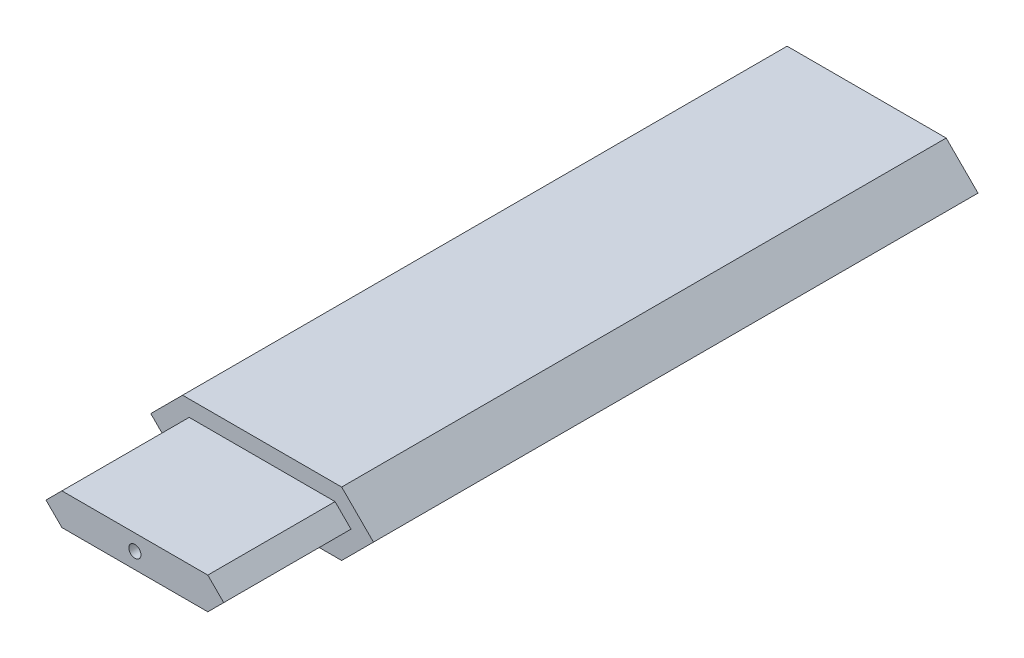
from build123d import *

# Parameters (mm, degrees)
EXTRUDE_1_DEPTH          = 18
CHAMFER_1_SIZE           = 5
CHAMFER_2_SIZE           = 5
CUT_EXTRUDE_1_DEPTH      = 8
EXTRUDE_2_REACH          = 696.741
EXTRUDE_2_END_RADIUS     = 240
EXTRUDE_3_DEPTH          = 5
EXTRUDE_4_REACH          = 929.644
EXTRUDE_4_END_RADIUS     = 232
SKETCH_10_R              = 12
CUT_EXTRUDE_7_DEPTH      = 695.872110635
CUT_EXTRUDE_7_DEPTH_BACK = 695.872110635
SKETCH_16_OUTSIDE_W      = 362.68
SKETCH_16_OUTSIDE_H      = 1204.68
SKETCH_16_OUTSIDE_W_2    = 100
SKETCH_16_OUTSIDE_H_2    = 230
SKETCH_21_R              = 1.9
CUT_EXTRUDE_17_DEPTH     = 233.862620444
SKETCH_34_OUTSIDE_W      = 120.25
SKETCH_34_OUTSIDE_H      = 70.25
CUT_EXTRUDE_18_DEPTH     = 40
CUT_EXTRUDE_19_DEPTH     = 41


with BuildPart() as part:
    # 草图4 → 放样1 section 0
    with BuildSketch(Plane(origin=(0, 10, 0), x_dir=(1, 0, 0), z_dir=(0, 1, 0))):
        with BuildLine():
            Line((25, 0), (-25, 0))
            Line((-25, 0), (-25, 630))
            Line((-25, 630), (0, 672.857142857))
            Line((0, 672.857142857), (25, 630))
            Line((25, 630), (25, 0))
        make_face()
    # 草图1 → 放样1 section 1
    with BuildSketch(Plane(origin=(0, 0, 0), x_dir=(1, 0, 0), z_dir=(0, 1, 0))):
        with BuildLine():
            Line((-35, 0), (35, 0))
            Line((35, 0), (35, 630))
            Line((35, 630), (0, 690))
            Line((0, 690), (-35, 630))
            Line((-35, 630), (-35, 0))
        make_face()
    loft_1 = loft()

    # 镜向1: 放样1 across plane
    add(loft_1.mirror(Plane.ZX))



with BuildPart() as body_2:
    # 草图5 → 凸台-拉伸1 (new, symmetric)
    with BuildSketch(Plane(origin=(0, 0, 0), x_dir=(1, 0, 0), z_dir=(0, 1, 0))):
        with BuildLine():
            ThreePointArc((-66.346774613, -65.189169183), (0, -55.5), (66.346774613, -65.189169183))
            ThreePointArc((66.346774613, -65.189169183), (73.061224406, -64.270510235), (76.791165228, -58.612302768))
            ThreePointArc((76.791165228, -58.612302768), (79, -30.5), (76.791165228, -2.387697232))
            ThreePointArc((76.791165228, -2.387697232), (0, -15.004503167), (-76.791165228, -2.387697232))
            ThreePointArc((-76.791165228, -2.387697232), (-79, -30.5), (-76.791165228, -58.612302768))
            ThreePointArc((-76.791165228, -58.612302768), (-73.061224406, -64.270510235), (-66.346774613, -65.189169183))
        make_face()
    extrude(amount=EXTRUDE_1_DEPTH, both=True)

    # 倒角1
    chamfer_1_edges = [body_2.edges().sort_by_distance(p)[0] for p in [
        (0, 18, 15.004503167),
        (-79, 18, 30.5),
        (-73.061224406, 18, 64.270510235),
        (0, 18, 55.5),
        (73.061224406, 18, 64.270510235),
        (0, -18, 55.5),
        (-73.061224406, -18, 64.270510235),
        (-79, -18, 30.5),
        (79, -18, 30.5),
        (73.061224406, -18, 64.270510235),
        (79, 18, 30.5),
    ]]
    chamfer(chamfer_1_edges, length=CHAMFER_1_SIZE)

    # 倒角2
    chamfer_2_edges = [body_2.edges().sort_by_distance(p)[0] for p in [
        (0, -18, 15.004503167),
    ]]
    chamfer(chamfer_2_edges, length=CHAMFER_2_SIZE)

    # 草图6 → 切除-拉伸1 (cut)
    with BuildSketch(Plane(origin=(0, 18, 0), x_dir=(1, 0, 0), z_dir=(0, 1, 0))):
        with BuildLine():
            ThreePointArc((67.221840199, -55.023712607), (68.932610365, -35.286223394), (68.335500378, -15.483731767))
            ThreePointArc((68.335500378, -15.483731767), (0, -25.004503167), (-68.335500378, -15.483731767))
            ThreePointArc((-68.335500378, -15.483731767), (-68.932610365, -35.286223394), (-67.221840199, -55.023712607))
            ThreePointArc((-67.221840199, -55.023712607), (0, -45.5), (67.221840199, -55.023712607))
        make_face()
    cut_extrude_1 = extrude(amount=-CUT_EXTRUDE_1_DEPTH, mode=Mode.SUBTRACT)

    # 镜向2: 切除-拉伸1 across plane
    add(cut_extrude_1.mirror(Plane.ZX), mode=Mode.SUBTRACT)


with BuildPart() as part_1:
    add(part.part)

    add(body_2.part)  # 凸台-拉伸2 merges body 2
    # 凸台-拉伸2: up to this cylinder (the profile starts inside it)
    extrude_2_end = Plane(origin=(0, 0, -224.995496833), z_dir=(0, -1, 0)) * Cylinder(EXTRUDE_2_END_RADIUS, 1874.482, mode=Mode.PRIVATE)
    # 草图7 → 凸台-拉伸2 (add, up to the surface)
    with BuildSketch(Plane.XY, mode=Mode.PRIVATE) as extrude_2_sk1:
        Polygon((-25.828427125, 12), (-37.828427125, 0), (-25.828427125, -12), (25.828427125, -12), (37.828427125, 0), (25.828427125, 12), align=None)
    extrude_2_tool1 = extrude(extrude_2_sk1.sketch, amount=EXTRUDE_2_REACH, mode=Mode.PRIVATE) & extrude_2_end
    add(extrude_2_tool1.solids().sort_by_distance((0, 0, 0))[0])

    # 草图8 → 凸台-拉伸3 (add)
    with BuildSketch(Plane(origin=(0, 0, 0), x_dir=(-1, 0, 0), z_dir=(0, 0, -1))):
        Polygon((25.828427125, 12), (-25.828427125, 12), (-37.828427125, 0), (-25.828427125, -12), (25.828427125, -12), (37.828427125, 0), align=None)
    extrude(amount=EXTRUDE_3_DEPTH)



with BuildPart() as body_2_2:
    # 草图9 → 旋转1 (revolve)
    with BuildSketch(Plane(origin=(0, 0, 0), x_dir=(1, 0, 0), z_dir=(0, 1, 0))):
        Polygon((0, -310), (0, -234), (-12, -234), (-22.5, -256), align=None)
    revolve(axis=Axis((0, 0, -690), (0, 0, 1)))


with BuildPart() as part_2:
    add(part_1.part)

    add(body_2_2.part)  # 凸台-拉伸4 merges body 2 2
    # 凸台-拉伸4: up to this cylinder (the profile starts inside it)
    extrude_4_end = Plane(origin=(0, 0, 287.5), z_dir=(0, -1, 0)) * Cylinder(EXTRUDE_4_END_RADIUS, 2324.288, mode=Mode.PRIVATE)
    # 草图10 → 凸台-拉伸4 (add, up to the surface)
    with BuildSketch(Plane(origin=(0, 0, 234), x_dir=(-1, 0, 0), z_dir=(0, 0, -1)), mode=Mode.PRIVATE) as extrude_4_sk1:
        with Locations(Location((0, 0, 0), (0, 0, 90))):
            Circle(SKETCH_10_R)
    extrude_4_tool1 = extrude(extrude_4_sk1.sketch, amount=EXTRUDE_4_REACH, mode=Mode.PRIVATE) & extrude_4_end
    add(extrude_4_tool1.solids().sort_by_distance((0, 0, 234))[0])

    # 草图16 outside → 切除-拉伸7 (cut, two sides: drawn at the far end of the back side and taken through both)
    with BuildSketch(Plane(origin=(0, 0, 0), x_dir=(1, 0, 0), z_dir=(0, 1, 0)).offset(-CUT_EXTRUDE_7_DEPTH_BACK)):
        with Locations((0, 190)):
            Rectangle(SKETCH_16_OUTSIDE_W, SKETCH_16_OUTSIDE_H)
        with Locations((0, 460)):
            Rectangle(SKETCH_16_OUTSIDE_W_2, SKETCH_16_OUTSIDE_H_2, mode=Mode.SUBTRACT)
    extrude(amount=CUT_EXTRUDE_7_DEPTH + CUT_EXTRUDE_7_DEPTH_BACK, mode=Mode.SUBTRACT)

    # 草图21 → 切除-拉伸17 (cut, through all)
    with BuildSketch(Plane.XY.offset(-345)):
        Circle(SKETCH_21_R)
    extrude(amount=-CUT_EXTRUDE_17_DEPTH, mode=Mode.SUBTRACT)

    # 草图34 outside → 切除-拉伸18 (cut)
    with BuildSketch(Plane.XY.offset(-345)):
        Rectangle(SKETCH_34_OUTSIDE_W, SKETCH_34_OUTSIDE_H)
        Polygon((-22.928932188, -5), (22.928932188, -5), (27.928932188, 0), (22.928932188, 5), (-22.928932188, 5), (-27.928932188, 0), align=None, mode=Mode.SUBTRACT)
    extrude(amount=-CUT_EXTRUDE_18_DEPTH, mode=Mode.SUBTRACT)

    # 草图35 → 切除-拉伸19 (cut)
    with BuildSketch(Plane(origin=(0, 0, -575), x_dir=(-1, 0, 0), z_dir=(0, 0, -1))):
        Polygon((-28.211774901, 0), (-23.011774901, -5.2), (23.011774901, -5.2), (28.211774901, 0), (23.011774901, 5.2), (-23.011774901, 5.2), align=None)
    extrude(amount=-CUT_EXTRUDE_19_DEPTH, mode=Mode.SUBTRACT)


solid = part_2.part
